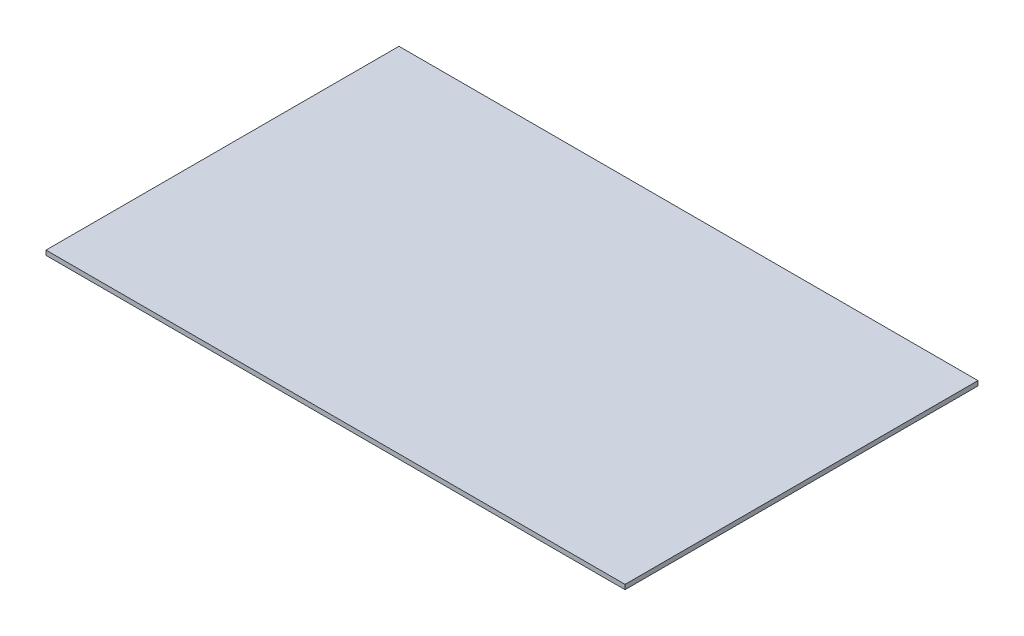
from build123d import *

# Parameters (mm, degrees)
SKETCH1_W           = 375.03
SKETCH1_H           = 228.615
BOSS_EXTRUDE1_DEPTH = 3


with BuildPart() as part:
    # Sketch1 → Boss-Extrude1 (new body)
    with BuildSketch(Plane(origin=(0, 0, 0), x_dir=(1, 0, 0), z_dir=(0, 1, 0))):
        with Locations((51.910932203, -39.795889831)):
            Rectangle(SKETCH1_W, SKETCH1_H)
    extrude(amount=BOSS_EXTRUDE1_DEPTH)


solid = part.part
